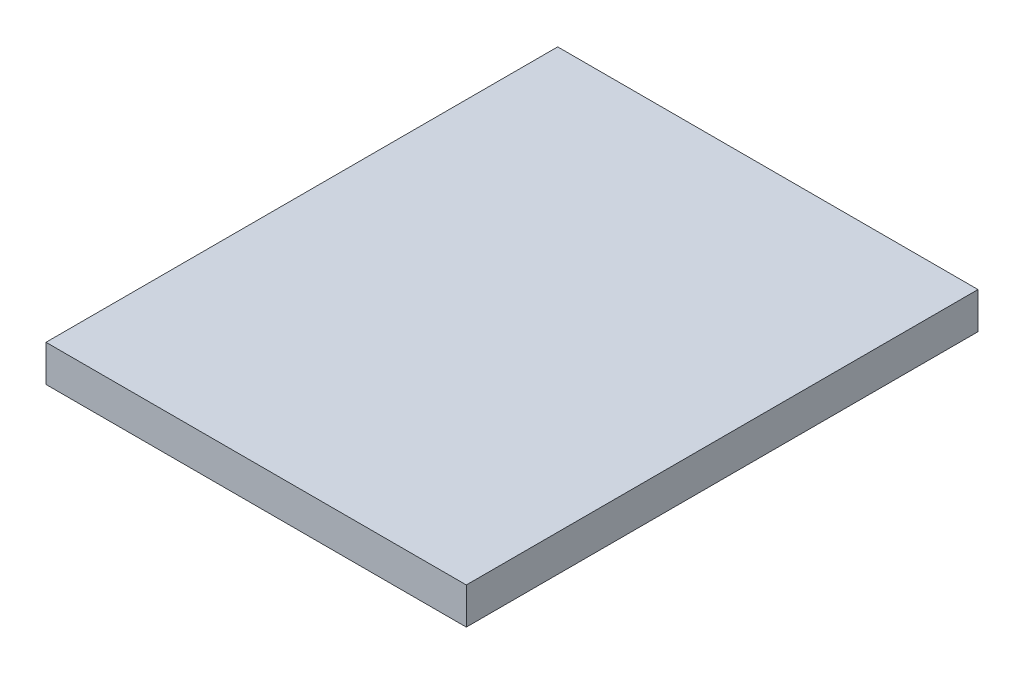
from build123d import *

# Parameters (mm, degrees)
SKETCH1_W           = 230
SKETCH1_H           = 280
BOSS_EXTRUDE1_DEPTH = 20
SKETCH2_W           = 199.41
SKETCH2_H           = 247
BOSS_EXTRUDE2_DEPTH = 10


with BuildPart() as part:
    # Sketch1 → Boss-Extrude1 (new body)
    with BuildSketch(Plane(origin=(0, 0, 0), x_dir=(1, 0, 0), z_dir=(0, 1, 0))):
        with Locations((115, 140)):
            Rectangle(SKETCH1_W, SKETCH1_H)
    extrude(amount=BOSS_EXTRUDE1_DEPTH)

    # Sketch2 → Boss-Extrude2 (add)
    with BuildSketch(Plane(origin=(0, 0, 0), x_dir=(1, 0, 0), z_dir=(0, 1, 0))):
        with Locations((115, 140)):
            Rectangle(SKETCH2_W, SKETCH2_H)
    extrude(amount=-BOSS_EXTRUDE2_DEPTH)


solid = part.part
